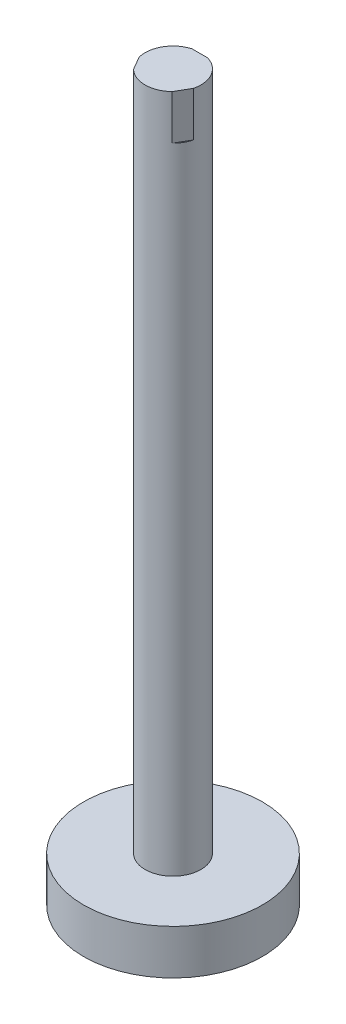
from build123d import *

# Parameters (mm, degrees)
SKETCH1_R           = 20
BOSS_EXTRUDE1_DEPTH = 10
SKETCH2_R           = 6.25
BOSS_EXTRUDE2_DEPTH = 152
CUT_EXTRUDE2_START  = -10
CUT_EXTRUDE2_DEPTH  = 10
CIRPATTERN1_COUNT   = 3
SKETCH8_R           = 8
CUT_EXTRUDE3_DEPTH  = 1


with BuildPart() as part:
    # Sketch1 → Boss-Extrude1 (new body)
    with BuildSketch(Plane(origin=(0, 0, 0), x_dir=(1, 0, 0), z_dir=(0, 1, 0))):
        with Locations(Location((0, 0, 0), (0, 0, 270))):
            Circle(SKETCH1_R)
    extrude(amount=-BOSS_EXTRUDE1_DEPTH)

    # Sketch2 → Boss-Extrude2 (add)
    with BuildSketch(Plane(origin=(0, 0, 0), x_dir=(1, 0, 0), z_dir=(0, 1, 0))):
        with Locations(Location((0, 0, 0), (0, 0, 270))):
            Circle(SKETCH2_R)
    extrude(amount=BOSS_EXTRUDE2_DEPTH)

    # Sketch7 → Cut-Extrude2 (cut)
    with BuildSketch(Plane(origin=(0, 152, 0), x_dir=(1, 0, 0), z_dir=(0, 1, 0)).offset(CUT_EXTRUDE2_START)):
        with BuildLine():
            Line((-1.75, 6), (1.75, 6))
            ThreePointArc((1.75, 6), (0, 6.25), (-1.75, 6))
        make_face()
    cut_extrude2 = extrude(amount=CUT_EXTRUDE2_DEPTH, mode=Mode.SUBTRACT)

    # CirPattern1: Cut-Extrude2 ×3 about axis
    cirpattern1_axis = Axis((0, 0, 0), (0, 1, 0))
    for i in range(1, CIRPATTERN1_COUNT):
        add(cut_extrude2.rotate(cirpattern1_axis, i * 360 / CIRPATTERN1_COUNT), mode=Mode.SUBTRACT)

    # Sketch8 → Cut-Extrude3 (cut)
    with BuildSketch(Plane.XZ.offset(10)):
        with Locations(Location((0, 0, 0), (0, 0, 270))):
            Circle(SKETCH8_R)
    extrude(amount=-CUT_EXTRUDE3_DEPTH, mode=Mode.SUBTRACT)


solid = part.part
